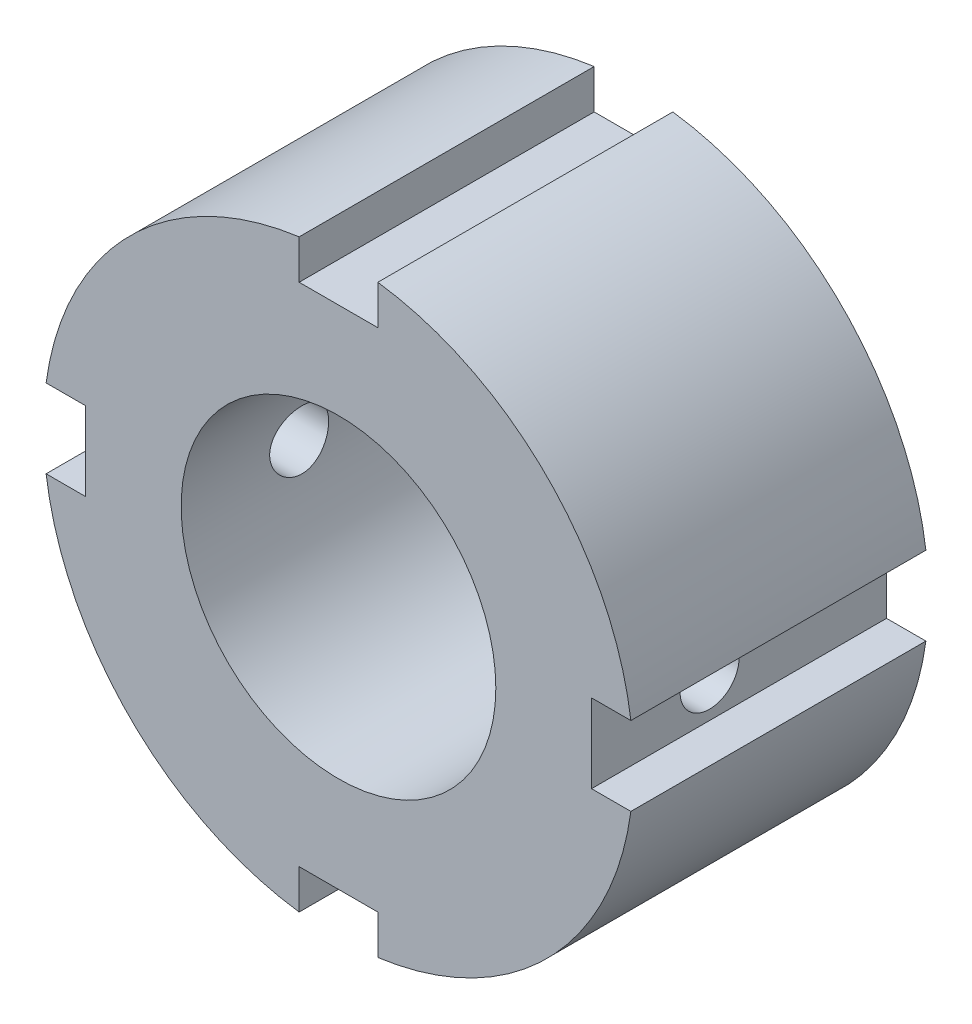
from build123d import *

# Parameters (mm, degrees)
ESBO_O1_R                  = 8
RESSALTO_EXTRUS_O1_DEPTH   = 15
CORTE_EXTRUS_O1_DEPTH      = 26.82634314
CORTE_EXTRUS_O1_DEPTH_BACK = 26.82634314
ESBO_O2_R                  = 1.5


with BuildPart() as part:
    # Esboço1 → Ressalto-extrusão1 (new body)
    with BuildSketch(Plane.XY):
        with BuildLine():
            Line((2, 12.866068747), (-2, 12.866068747))
            Line((-2, 12.866068747), (-2, 14.866068747))
            ThreePointArc((-2, 14.866068747), (-10.606601718, 10.606601718), (-14.866068747, 2))
            Line((-14.866068747, 2), (-12.866068747, 2))
            Line((-12.866068747, 2), (-12.866068747, -2))
            Line((-12.866068747, -2), (-14.866068747, -2))
            ThreePointArc((-14.866068747, -2), (-10.606601718, -10.606601718), (-2, -14.866068747))
            Line((-2, -14.866068747), (-2, -12.866068747))
            Line((-2, -12.866068747), (2, -12.866068747))
            Line((2, -12.866068747), (2, -14.866068747))
            ThreePointArc((2, -14.866068747), (10.606601718, -10.606601718), (14.866068747, -2))
            Line((14.866068747, -2), (12.866068747, -2))
            Line((12.866068747, -2), (12.866068747, 2))
            Line((12.866068747, 2), (14.866068747, 2))
            ThreePointArc((14.866068747, 2), (10.606601718, 10.606601718), (2, 14.866068747))
            Line((2, 14.866068747), (2, 12.866068747))
        make_face()
        Circle(ESBO_O1_R, mode=Mode.SUBTRACT)
    extrude(amount=RESSALTO_EXTRUS_O1_DEPTH)

    # Esboço2 → Corte-extrusão1 (cut, two sides: drawn at the far end of the back side and taken through both)
    with BuildSketch(Plane(origin=(0, 0, 0), x_dir=(0, 0, -1), z_dir=(1, 0, 0)).offset(-CORTE_EXTRUS_O1_DEPTH_BACK)):
        with Locations((-9, 0)):
            Circle(ESBO_O2_R)
    extrude(amount=CORTE_EXTRUS_O1_DEPTH + CORTE_EXTRUS_O1_DEPTH_BACK, mode=Mode.SUBTRACT)


solid = part.part
